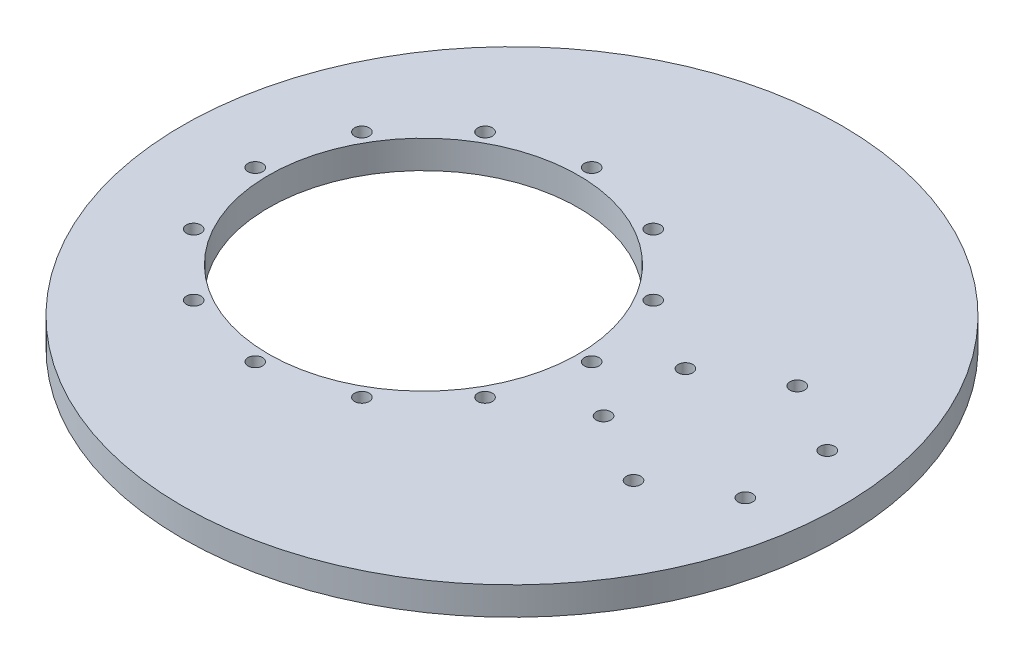
from build123d import *

# Parameters (mm, degrees)
SKETCH1_R                       = 74.45
SKETCH1_R_2                     = 35
BOSS_EXTRUDE1_DEPTH             = 6.35
M4X0_7_TAPPED_HOLE1_D           = 3.3
M4X0_7_TAPPED_HOLE1_ON_FACE_2_D = 3.3


with BuildPart() as part:
    # Sketch1 → Boss-Extrude1 (new body)
    with BuildSketch(Plane(origin=(0, 0, 0), x_dir=(1, 0, 0), z_dir=(0, 1, 0))):
        with Locations(Location((20, 0, 0), (0, 0, 270))):
            Circle(SKETCH1_R)
        with Locations(Location((0, 0, 0), (0, 0, 270))):
            Circle(SKETCH1_R_2, mode=Mode.SUBTRACT)
    extrude(amount=BOSS_EXTRUDE1_DEPTH)

    # M4x0.7 Tapped Hole1 (through all)
    with Locations(Plane(origin=(0, 0, -38), x_dir=(0, 0, -1), z_dir=(0, -1, 0))):
        with Locations((0, 0), (-5.091034656, -19), (-19, -32.908965344), (-38, -38), (-57, -32.908965344), (-70.908965344, -19), (-76, 0), (-70.908965344, 19), (-57, 32.908965344), (-38, 38), (-5.091034656, 19), (-19, 32.908965344)):
            Hole(M4X0_7_TAPPED_HOLE1_D / 2)

    # M4x0.7 Tapped Hole1 on face 2 (through all)
    with Locations(Plane(origin=(65.95, 6.35, -18.5), x_dir=(0, 0, 1), z_dir=(0, 1, 0))):
        with Locations((0, 0), (9.25, 16.02146997), (27.75, 16.02146997), (37, 0), (27.75, -16.02146997), (9.25, -16.02146997)):
            Hole(M4X0_7_TAPPED_HOLE1_ON_FACE_2_D / 2)


solid = part.part
